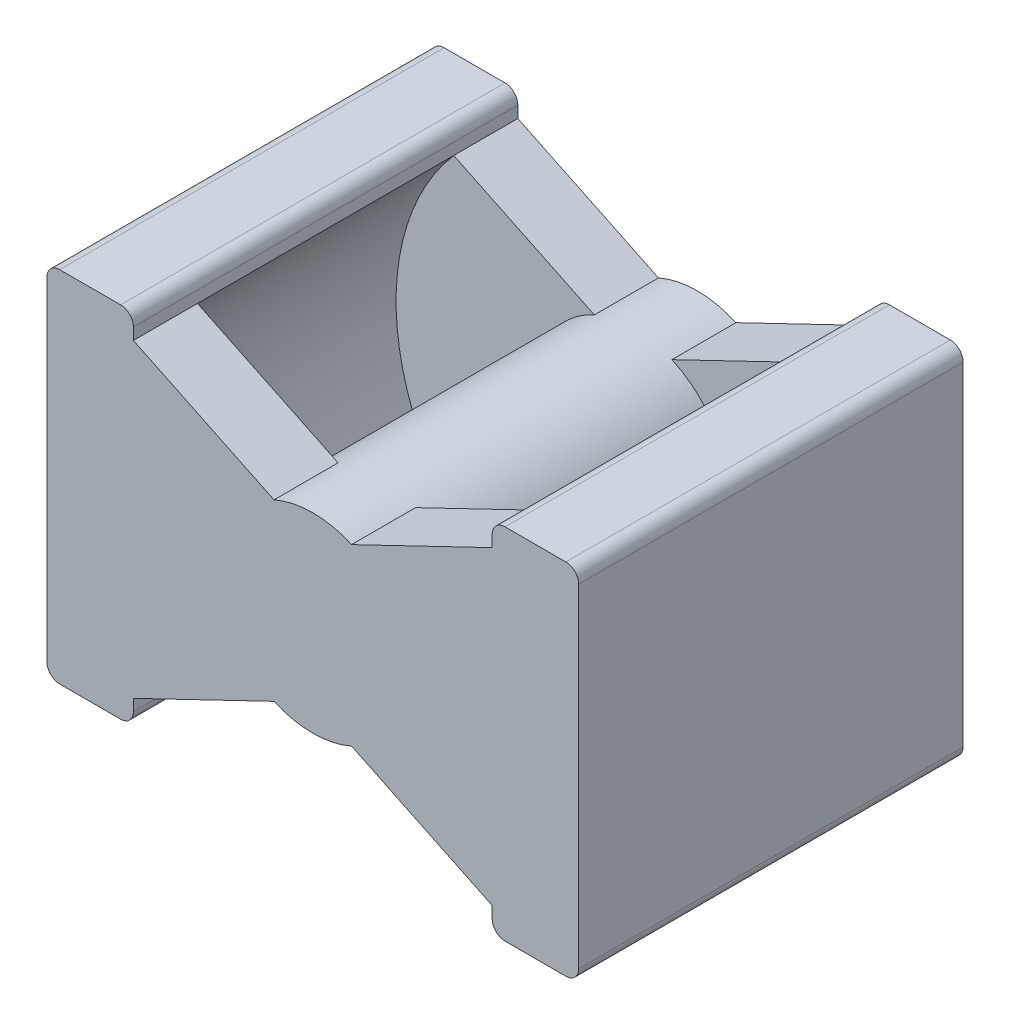
from build123d import *

# Parameters (mm, degrees)
BOSS_EXTRUDE2_DEPTH = 30
CUT_EXTRUDE1_START  = -5
SKETCH4_R           = 18.5
SKETCH4_R_2         = 7.45
CUT_EXTRUDE1_DEPTH  = 20


with BuildPart() as part:
    # Sketch1 → Boss-Extrude2 (new body)
    with BuildSketch(Plane.XY):
        with BuildLine():
            ThreePointArc((0, 1), (0.292893219, 0.292893219), (1, 0))
            Line((1, 0), (5.75, 0))
            ThreePointArc((5.75, 0), (6.457106781, 0.292893219), (6.75, 1))
            Line((6.75, 1), (6.75, 1.906613378))
            Line((6.75, 1.906613378), (17.725, 7.191778867))
            ThreePointArc((17.725, 7.191778867), (13.3, 14), (17.725, 20.808221133))
            Line((17.725, 20.808221133), (6.75, 26.093386622))
            Line((6.75, 26.093386622), (6.75, 27))
            ThreePointArc((6.75, 27), (6.457106781, 27.707106781), (5.75, 28))
            Line((5.75, 28), (1, 28))
            ThreePointArc((1, 28), (0.292893219, 27.707106781), (0, 27))
            Line((0, 27), (0, 1))
        make_face()
        with BuildLine():
            ThreePointArc((17.725, 20.808221133), (13.3, 14), (17.725, 7.191778867))
            ThreePointArc((17.725, 7.191778867), (20.75, 6.55), (23.775, 7.191778867))
            ThreePointArc((23.775, 7.191778867), (26.996549047, 9.940058498), (28.2, 14))
            ThreePointArc((28.2, 14), (26.996549047, 18.059941502), (23.775, 20.808221133))
            ThreePointArc((23.775, 20.808221133), (20.75, 21.45), (17.725, 20.808221133))
        make_face()
        with BuildLine():
            ThreePointArc((28.2, 14), (26.996549047, 9.940058498), (23.775, 7.191778867))
            Line((23.775, 7.191778867), (34.75, 1.906613378))
            Line((34.75, 1.906613378), (34.75, 1))
            ThreePointArc((34.75, 1), (35.042893219, 0.292893219), (35.75, 0))
            Line((35.75, 0), (40.5, 0))
            ThreePointArc((40.5, 0), (41.207106781, 0.292893219), (41.5, 1))
            Line((41.5, 1), (41.5, 27))
            ThreePointArc((41.5, 27), (41.207106781, 27.707106781), (40.5, 28))
            Line((40.5, 28), (35.75, 28))
            ThreePointArc((35.75, 28), (35.042893219, 27.707106781), (34.75, 27))
            Line((34.75, 27), (34.75, 26.093386622))
            Line((34.75, 26.093386622), (23.775, 20.808221133))
            ThreePointArc((23.775, 20.808221133), (26.996549047, 18.059941502), (28.2, 14))
        make_face()
    extrude(amount=BOSS_EXTRUDE2_DEPTH)

    # Sketch4 → Cut-Extrude1 (cut)
    with BuildSketch(Plane(origin=(0, 0, 0), x_dir=(-1, 0, 0), z_dir=(0, 0, -1)).offset(CUT_EXTRUDE1_START)):
        with Locations((-20.75, 14)):
            Circle(SKETCH4_R)
        with Locations(Location((-20.75, 14, 0), (0, 0, 293.956332154))):
            Circle(SKETCH4_R_2, mode=Mode.SUBTRACT)
    extrude(amount=-CUT_EXTRUDE1_DEPTH, mode=Mode.SUBTRACT)


solid = part.part
